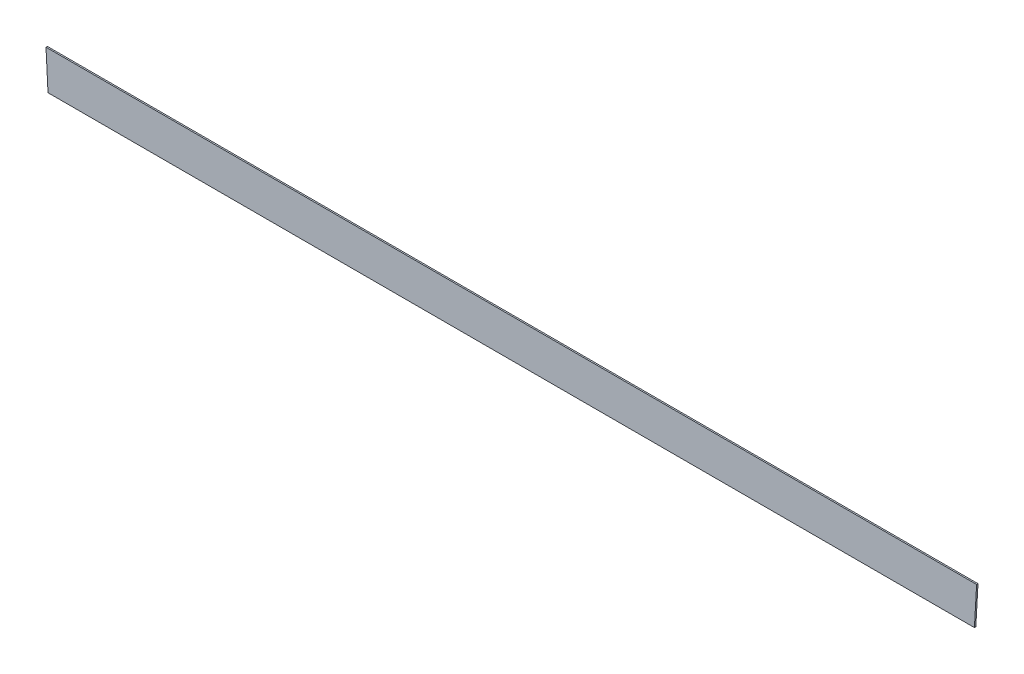
from build123d import *

# Parameters (mm, degrees)
BOSS_EXTRUDE1_DEPTH = 2


with BuildPart() as part:
    # Sketch1 → Boss-Extrude1 (new body)
    with BuildSketch(Plane.XY):
        Polygon((-662.5, 27.5), (-665.382427861, 27.5), (-662.5, -27.5), (662.5, -27.5), (665.617572139, 27.5), (662.5, 27.5), align=None)
    extrude(amount=BOSS_EXTRUDE1_DEPTH)


solid = part.part
